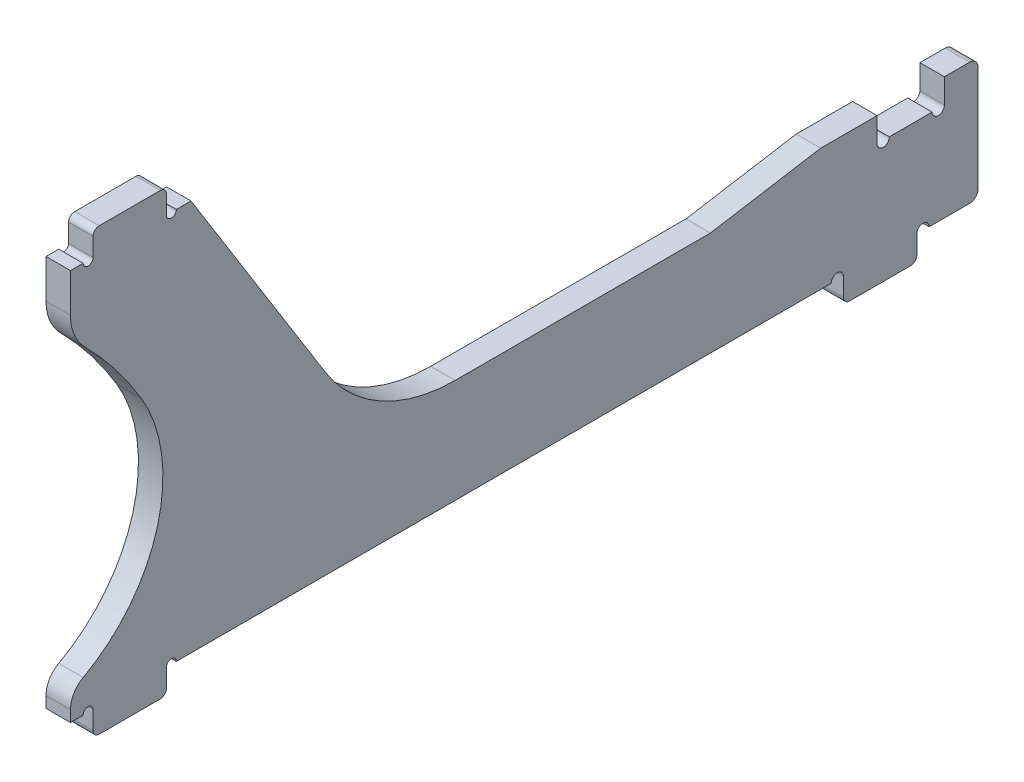
from build123d import *

# Parameters (mm, degrees)
BOSS_EXTRUDE1_DEPTH = 2


with BuildPart() as part:
    # Sketch4 → Boss-Extrude1 (new body)
    with BuildSketch(Plane(origin=(0, 0, 0), x_dir=(0, 0, -1), z_dir=(1, 0, 0))):
        with BuildLine():
            Line((34.101087746, -13.088045862), (34.101087746, -4.462231487))
            ThreePointArc((34.101087746, -4.462231487), (33.899842921, -3.9763835), (33.413994934, -3.775138674))
            Line((33.413994934, -3.775138674), (31.351087746, -3.775138674))
            Line((31.351087746, -3.775138674), (31.351087746, -5.775138674))
            ThreePointArc((31.351087746, -5.775138674), (30.851087746, -6.275138674), (30.351087746, -5.775138674))
            Line((30.351087746, -5.775138674), (26.851087746, -5.775138674))
            ThreePointArc((26.851087746, -5.775138674), (26.351087746, -6.275138674), (25.851087746, -5.775138674))
            Line((25.851087746, -5.775138674), (25.851087746, -3.775138674))
            Line((25.851087746, -3.775138674), (21.233669279, -3.775138674))
            Line((21.233669279, -3.775138674), (12.233669279, -5.275138674))
            Line((12.233669279, -5.275138674), (-8.644965801, -5.275138674))
            ThreePointArc((-8.644965801, -5.275138674), (-14.710069272, -3.705121285), (-19.251601877, 0.610538145))
            Line((-19.251601877, 0.610538145), (-30.235935202, 18.224861326))
            Line((-30.235935202, 18.224861326), (-31.434679787, 18.224861326))
            ThreePointArc((-31.434679787, 18.224861326), (-31.839000225, 17.820540888), (-32.243320663, 18.224861326))
            Line((-32.243320663, 18.224861326), (-32.243320663, 19.724861326))
            ThreePointArc((-32.243320663, 19.724861326), (-32.389767272, 20.078414716), (-32.743320663, 20.224861326))
            Line((-32.743320663, 20.224861326), (-37.743320663, 20.224861326))
            ThreePointArc((-37.743320663, 20.224861326), (-38.096874053, 20.078414716), (-38.243320663, 19.724861326))
            Line((-38.243320663, 19.724861326), (-38.243320663, 18.224861326))
            ThreePointArc((-38.243320663, 18.224861326), (-38.647641101, 17.820540888), (-39.051961539, 18.224861326))
            Line((-39.051961539, 18.224861326), (-40.090546725, 18.224861326))
            Line((-40.090546725, 18.224861326), (-40.090546725, 15.063013808))
            ThreePointArc((-40.090546725, 15.063013808), (-39.78872162, 13.538709885), (-38.928795501, 12.244442559))
            ThreePointArc((-38.928795501, 12.244442559), (-36.430620964, 9.401503447), (-34.296876278, 6.275753549))
            ThreePointArc((-34.296876278, 6.275753549), (-32.973480494, -3.425461249), (-39.047864509, -11.104445805))
            ThreePointArc((-39.047864509, -11.104445805), (-39.810232099, -11.839329581), (-40.090546725, -12.860447701))
            Line((-40.090546725, -12.860447701), (-40.090546725, -13.775138674))
            Line((-40.090546725, -13.775138674), (-39.051961539, -13.775138674))
            ThreePointArc((-39.051961539, -13.775138674), (-38.647641101, -13.370818236), (-38.243320663, -13.775138674))
            Line((-38.243320663, -13.775138674), (-38.243320663, -15.275138674))
            ThreePointArc((-38.243320663, -15.275138674), (-38.096874053, -15.628692065), (-37.743320663, -15.775138674))
            Line((-37.743320663, -15.775138674), (-32.743320663, -15.775138674))
            ThreePointArc((-32.743320663, -15.775138674), (-32.389767272, -15.628692065), (-32.243320663, -15.275138674))
            Line((-32.243320663, -15.275138674), (-32.243320663, -13.775138674))
            ThreePointArc((-32.243320663, -13.775138674), (-31.839000225, -13.370818236), (-31.434679787, -13.775138674))
            Line((-31.434679787, -13.775138674), (22.101087746, -13.775138674))
            ThreePointArc((22.101087746, -13.775138674), (22.601087746, -13.275138674), (23.101087746, -13.775138674))
            Line((23.101087746, -13.775138674), (23.101087746, -15.275138674))
            ThreePointArc((23.101087746, -15.275138674), (23.247534356, -15.628692065), (23.601087746, -15.775138674))
            Line((23.601087746, -15.775138674), (28.601087746, -15.775138674))
            ThreePointArc((28.601087746, -15.775138674), (28.954641137, -15.628692065), (29.101087746, -15.275138674))
            Line((29.101087746, -15.275138674), (29.101087746, -13.775138674))
            ThreePointArc((29.101087746, -13.775138674), (29.601087746, -13.275138674), (30.101087746, -13.775138674))
            Line((30.101087746, -13.775138674), (33.413994934, -13.775138674))
            ThreePointArc((33.413994934, -13.775138674), (33.899842921, -13.573893849), (34.101087746, -13.088045862))
        make_face()
    extrude(amount=BOSS_EXTRUDE1_DEPTH)


solid = part.part
